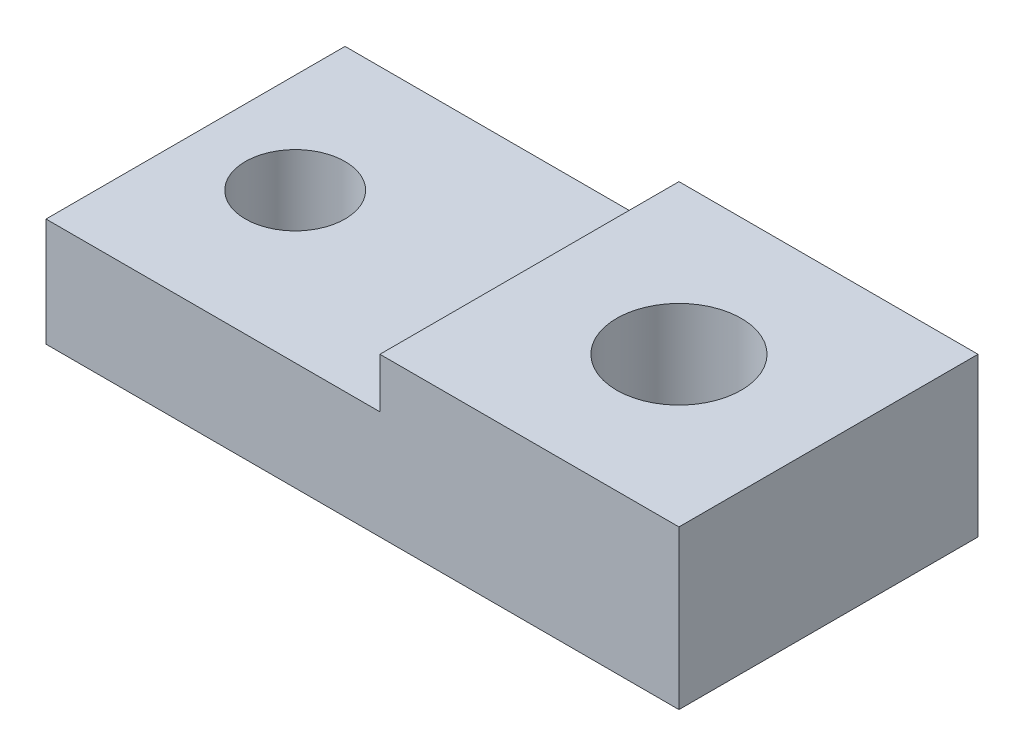
from build123d import *

# Parameters (mm, degrees)
SKETCH1_W             = 12.7
SKETCH1_H             = 6
BOSS_EXTRUDE1_DEPTH   = 1.5875
M3X0_5_TAPPED_HOLE1_D = 2.5
SKETCH4_W             = 6.7
SKETCH4_H             = 1
CUT_EXTRUDE1_DEPTH    = 9.879338728
SKETCH5_R             = 1
CUT_EXTRUDE2_DEPTH    = 8.352083038


with BuildPart() as part:
    # Sketch1 → Boss-Extrude1 (new, symmetric)
    with BuildSketch(Plane(origin=(0, 0, 0), x_dir=(1, 0, 0), z_dir=(0, 1, 0))):
        Rectangle(SKETCH1_W, SKETCH1_H)
    extrude(amount=BOSS_EXTRUDE1_DEPTH, both=True)

    # M3x0.5 Tapped Hole1 (through all)
    with Locations(Plane(origin=(0, 1.5875, 0), x_dir=(1, 0, 0), z_dir=(0, 1, 0))):
        with Locations((3.35, 0)):
            Hole(M3X0_5_TAPPED_HOLE1_D / 2)

    # Sketch4 → Cut-Extrude1 (cut, through all)
    with BuildSketch(Plane.XY.offset(3)):
        with Locations((-3, 1.0875)):
            Rectangle(SKETCH4_W, SKETCH4_H)
    extrude(amount=-CUT_EXTRUDE1_DEPTH, mode=Mode.SUBTRACT)

    # Sketch5 → Cut-Extrude2 (cut, through all)
    with BuildSketch(Plane(origin=(0, 0.5875, 0), x_dir=(1, 0, 0), z_dir=(0, 1, 0))):
        with Locations(Location((-4.35, 0, 0), (0, 0, 270))):
            Circle(SKETCH5_R)
    extrude(amount=-CUT_EXTRUDE2_DEPTH, mode=Mode.SUBTRACT)


solid = part.part
